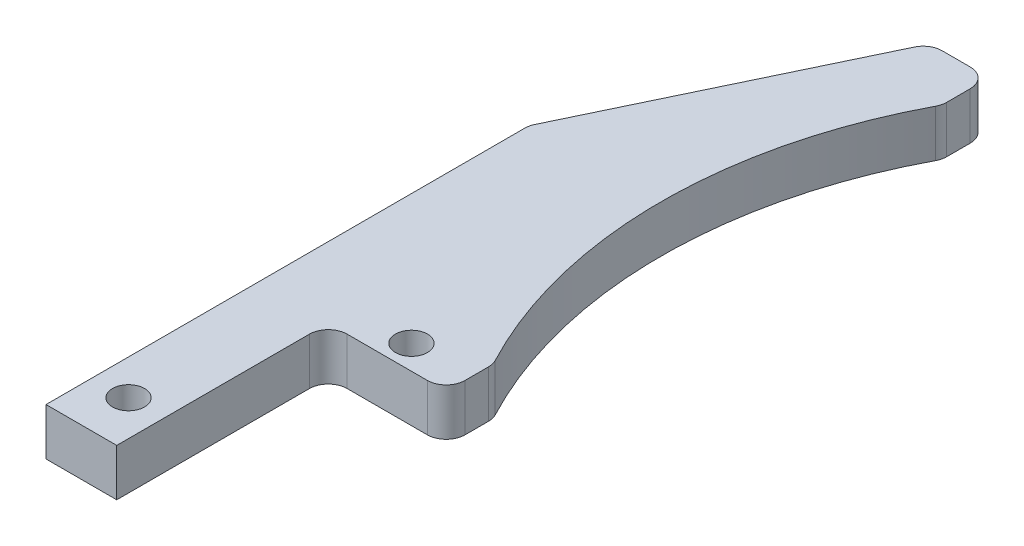
from build123d import *

# Parameters (mm, degrees)
BOSS_EXTRUDE1_DEPTH     = 6.35
CUT_EXTRUDE2_DEPTH      = 105.775
CUT_EXTRUDE2_DEPTH_BACK = 105.775
SKETCH5_R               = 2.159
FILLET1_R               = 2.54


with BuildPart() as part:
    # Sketch1 → Boss-Extrude1 (new body)
    with BuildSketch(Plane(origin=(0, 0, 0), x_dir=(1, 0, 0), z_dir=(0, 1, 0))):
        with BuildLine():
            Line((0, 0), (9.525, 0))
            Line((9.525, 0), (9.525, 28.48967645))
            Line((9.525, 28.48967645), (25.4, 28.48967645))
            Line((25.4, 28.48967645), (25.4, 34.83967645))
            ThreePointArc((25.4, 34.83967645), (17.756048931, 65.044838225), (25.4, 95.25))
            Line((25.4, 95.25), (25.4, 101.6))
            Line((25.4, 101.6), (17.4625, 101.6))
            Line((17.4625, 101.6), (0, 65.044838225))
            Line((0, 65.044838225), (0, 0))
        make_face()
    extrude(amount=BOSS_EXTRUDE1_DEPTH)

    # Sketch5 → Cut-Extrude2 (cut, two sides: drawn at the far end of the back side and taken through both)
    with BuildSketch(Plane(origin=(0, 3.175, 0), x_dir=(1, 0, 0), z_dir=(0, 1, 0)).offset(-CUT_EXTRUDE2_DEPTH_BACK)):
        with Locations(Location((17.4625, 31.75, 0), (0, 0, 270))):
            Circle(SKETCH5_R)
        with Locations(Location((4.7625, 6.35, 0), (0, 0, 270))):
            Circle(SKETCH5_R)
    extrude(amount=CUT_EXTRUDE2_DEPTH + CUT_EXTRUDE2_DEPTH_BACK, mode=Mode.SUBTRACT)

    # Fillet1
    fillet1_edges = [part.edges().sort_by_distance(p)[0] for p in [
        (0, 3.175, -65.044838225),
        (17.4625, 3.175, -101.6),
        (25.4, 3.175, -101.6),
        (25.4, 3.175, -95.25),
        (25.4, 3.175, -34.83967645),
        (25.4, 3.175, -28.48967645),
        (9.525, 3.175, -28.48967645),
    ]]
    fillet(fillet1_edges, radius=FILLET1_R)


solid = part.part
